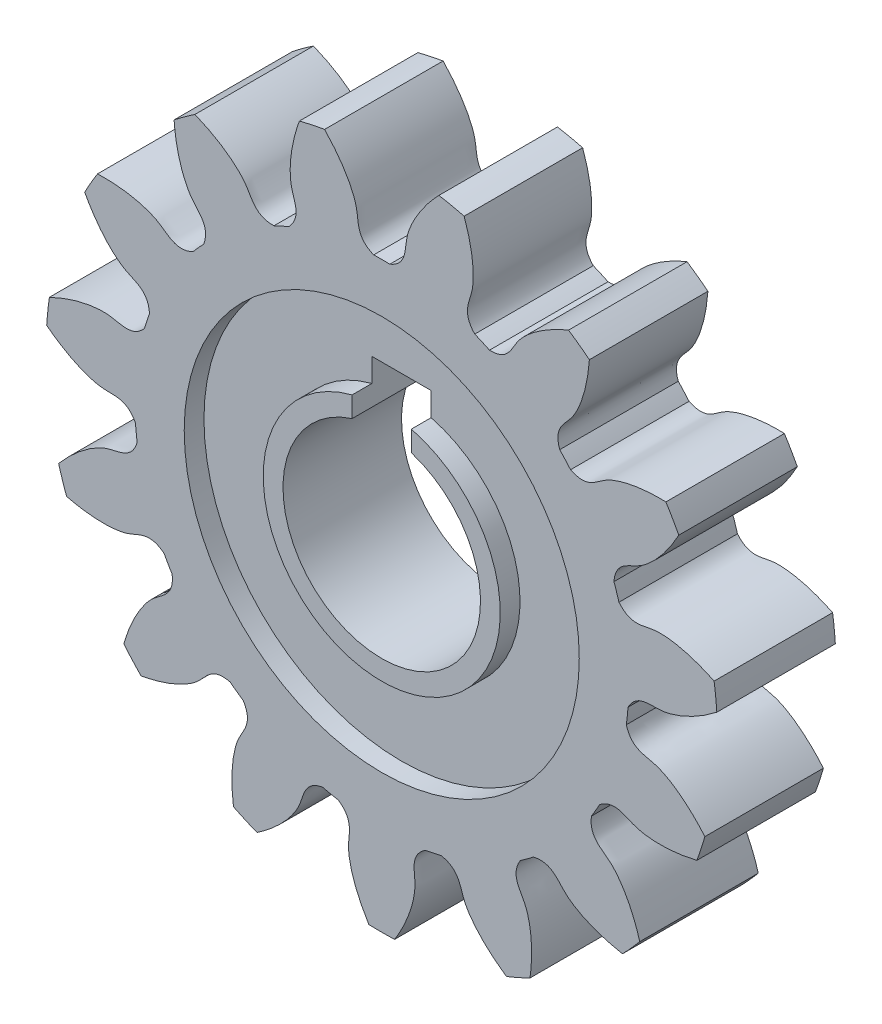
from build123d import *

# Parameters (mm, degrees)
SKETCH_1_R               = 17.000000007
EXTRUDE_1_DEPTH          = 6
CUT_EXTRUDE_1_DEPTH      = 25.779023396
PATTERN_CIRCULAR_1_COUNT = 15
CUT_EXTRUDE_2_REACH      = 26.753
SKETCH_5_R               = 10
SKETCH_5_R_2             = 6
CUT_EXTRUDE_3_DEPTH      = 1


with BuildPart() as part:
    # 草图1 → 凸台-拉伸1 (new body)
    with BuildSketch(Plane.XY):
        Circle(SKETCH_1_R)
    extrude(amount=EXTRUDE_1_DEPTH)

    # 草图2 → 切除-拉伸1 (cut, through all)
    with BuildSketch(Plane.XY):
        with BuildLine():
            ThreePointArc((0.408570082, 12.493321035), (0, 12.5), (-0.408570082, 12.493321035))
            add(Edge.make_bspline(
                [(-0.408570082, 12.493321035), (-1.314426117, 12.868820457), (-1.144226268, 13.572658845), (-1.302520973, 14.21700753), (-1.314866358, 14.263316593), (-1.329697695, 14.314787647), (-1.347220475, 14.371338609), (-1.367644802, 14.432879951), (-1.391176061, 14.499316195), (-1.418017606, 14.570545533), (-1.448369717, 14.646460034), (-1.482429702, 14.72694568), (-1.520391649, 14.811882453), (-1.562446298, 14.90114442), (-1.608780868, 14.994599817), (-1.659578902, 15.092111141), (-1.715020121, 15.193535247), (-1.77528026, 15.298723442), (-1.84053093, 15.407521596), (-1.910939461, 15.519770239), (-1.986668766, 15.635304677), (-2.067877193, 15.753955106), (-2.154718392, 15.875546727), (-2.247341174, 15.999899865), (-2.345889381, 16.1268301), (-2.450501754, 16.256148389), (-2.56131181, 16.387661197), (-2.678447713, 16.521170635), (-2.802032159, 16.656474594), (-2.932182257, 16.793366884), (-3.069009412, 16.931637384), (-3.212619223, 17.071072181), (-3.36311137, 17.21145372), (-3.520579511, 17.352560961), (-3.68511119, 17.494169528), (-3.856787733, 17.636051869), (-4.035684163, 17.777977411), (-4.22186911, 17.919712728), (-4.415404727, 18.0610217), (-4.616346612, 18.201665683), (-4.82474373, 18.341403675), (-5.040638346, 18.479992484), (-5.264065953, 18.617186906), (-5.495055218, 18.752739894), (-5.733627883, 18.88640274), (-6.065171324, 19.063537407), (-6.320303827, 19.190067932), (-6.493676778, 19.271856413)],
                knots=[0, 0, 0, 0, 0.202473101, 0.206978902, 0.212085478, 0.217792827, 0.224100949, 0.231009845, 0.238519514, 0.246629958, 0.255341174, 0.264653164, 0.274565928, 0.285079465, 0.296193776, 0.307908861, 0.320224719, 0.33314135, 0.346658755, 0.360776934, 0.375495886, 0.390815612, 0.406736111, 0.423257384, 0.440379431, 0.458102251, 0.476425844, 0.495350211, 0.514875352, 0.535001266, 0.555727954, 0.577055415, 0.59898365, 0.621512658, 0.64464244, 0.668372996, 0.692704325, 0.717636428, 0.743169304, 0.769302954, 0.796037377, 0.823372574, 0.851308544, 0.879845288, 0.908982806, 0.938721097, 1, 1, 1, 1], degree=3))
            ThreePointArc((-6.493676778, 19.271856413), (0, 20.336476777), (6.493676778, 19.271856413))
            add(Edge.make_bspline(
                [(0.408570082, 12.493321035), (1.314426117, 12.868820457), (1.144226268, 13.572658845), (1.302520973, 14.21700753), (1.314866358, 14.263316593), (1.329697695, 14.314787647), (1.347220475, 14.371338609), (1.367644802, 14.432879951), (1.391176061, 14.499316195), (1.418017606, 14.570545533), (1.448369717, 14.646460034), (1.482429702, 14.72694568), (1.520391649, 14.811882453), (1.562446298, 14.90114442), (1.608780868, 14.994599817), (1.659578902, 15.092111141), (1.715020121, 15.193535247), (1.77528026, 15.298723442), (1.84053093, 15.407521596), (1.910939461, 15.519770239), (1.986668766, 15.635304677), (2.067877193, 15.753955106), (2.154718392, 15.875546727), (2.247341174, 15.999899865), (2.345889381, 16.1268301), (2.450501754, 16.256148389), (2.56131181, 16.387661197), (2.678447713, 16.521170635), (2.802032159, 16.656474594), (2.932182257, 16.793366884), (3.069009412, 16.931637384), (3.212619223, 17.071072181), (3.36311137, 17.21145372), (3.520579511, 17.352560961), (3.68511119, 17.494169528), (3.856787733, 17.636051869), (4.035684163, 17.777977411), (4.22186911, 17.919712728), (4.415404727, 18.0610217), (4.616346612, 18.201665683), (4.82474373, 18.341403675), (5.040638346, 18.479992484), (5.264065953, 18.617186906), (5.495055218, 18.752739894), (5.733627883, 18.88640274), (6.065171324, 19.063537407), (6.320303827, 19.190067932), (6.493676778, 19.271856413)],
                knots=[0, 0, 0, 0, 0.202473101, 0.206978902, 0.212085478, 0.217792827, 0.224100949, 0.231009845, 0.238519514, 0.246629958, 0.255341174, 0.264653164, 0.274565928, 0.285079465, 0.296193776, 0.307908861, 0.320224719, 0.33314135, 0.346658755, 0.360776934, 0.375495886, 0.390815612, 0.406736111, 0.423257384, 0.440379431, 0.458102251, 0.476425844, 0.495350211, 0.514875352, 0.535001266, 0.555727954, 0.577055415, 0.59898365, 0.621512658, 0.64464244, 0.668372996, 0.692704325, 0.717636428, 0.743169304, 0.769302954, 0.796037377, 0.823372574, 0.851308544, 0.879845288, 0.908982806, 0.938721097, 1, 1, 1, 1], degree=3))
        make_face()
    cut_extrude_1 = extrude(amount=CUT_EXTRUDE_1_DEPTH, mode=Mode.SUBTRACT)

    # 阵列(圆周)1: 切除-拉伸1 ×15 about axis
    pattern_circular_1_axis = Axis((0, 0, -0.5), (0, 0, 1))
    for i in range(1, PATTERN_CIRCULAR_1_COUNT):
        add(cut_extrude_1.rotate(pattern_circular_1_axis, i * 360 / PATTERN_CIRCULAR_1_COUNT), mode=Mode.SUBTRACT)

    # 草图4 → 切除-拉伸2 (cut, up to next)
    with BuildSketch(Plane.XY.offset(6), mode=Mode.PRIVATE) as cut_extrude_2_sk1:
        with BuildLine():
            Line((-1.5, 4.769696007), (-1.5, 7))
            Line((-1.5, 7), (1.5, 7))
            Line((1.5, 7), (1.5, 4.769696007))
            ThreePointArc((1.5, 4.769696007), (0, -5), (-1.5, 4.769696007))
        make_face()
    cut_extrude_2_tool1 = extrude(cut_extrude_2_sk1.sketch, amount=-CUT_EXTRUDE_2_REACH, mode=Mode.PRIVATE) & part.part
    add(cut_extrude_2_tool1.solids().sort_by_distance((0, 0.43796, 6))[0], mode=Mode.SUBTRACT)

    # 草图5 → 切除-拉伸3 (cut)
    with BuildSketch(Plane.XY.offset(6)):
        Circle(SKETCH_5_R)
        Circle(SKETCH_5_R_2, mode=Mode.SUBTRACT)
    extrude(amount=-CUT_EXTRUDE_3_DEPTH, mode=Mode.SUBTRACT)


solid = part.part
